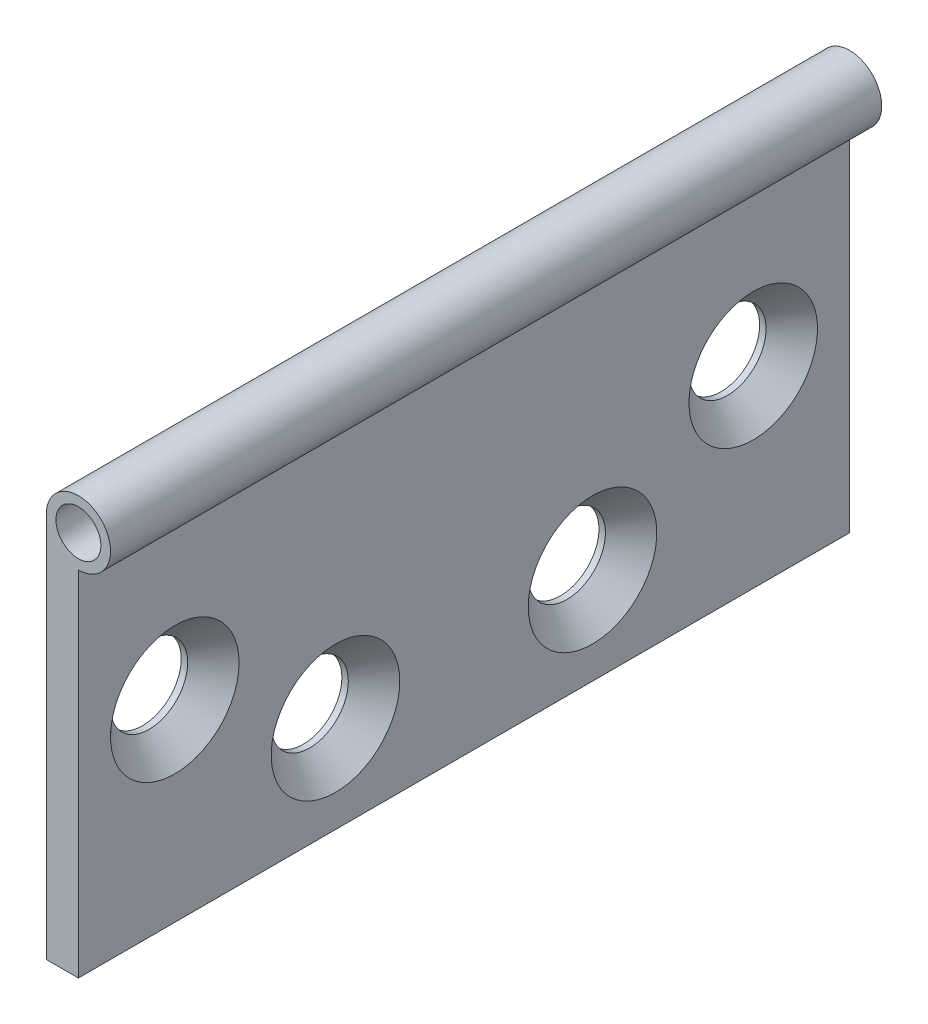
from build123d import *

# Parameters (mm, degrees)
SKETCH_1_W                  = 5
SKETCH_1_H                  = 60
EXTRUDE_2_DEPTH             = 60
SKETCH_2_R                  = 5
SKETCH_3_R                  = 3.5
CUT_EXTRUDE_1_DEPTH         = 137.839321834
HOLE_WIZARD_M101_AT_2_COUNT = 2
HOLE_WIZARD_M101_AT_2_PITCH = 29.154759474


with BuildPart() as part:
    # Эскиз1 → Вытянуть-Тонкостенный2 (new, symmetric)
    with BuildSketch(Plane.XY):
        with Locations((2.5, 30)):
            Rectangle(SKETCH_1_W, SKETCH_1_H)
    extrude(amount=EXTRUDE_2_DEPTH, both=True)

    # По траектории1: sweep along a curve in space
    with BuildLine() as sweep_1_path:
        Line((0, 60, 60), (0, 60, -60))
    # Эскиз2 → По траектории1 (sweep)
    with BuildSketch(Plane.XY.offset(60)):
        with Locations((5, 60)):
            Circle(SKETCH_2_R)
    sweep(path=sweep_1_path.line)

    # Эскиз3 → Вырез-Вытянуть1 (cut, through all)
    with BuildSketch(Plane.XY.offset(60)):
        with Locations((5, 60)):
            Circle(SKETCH_3_R)
    extrude(amount=-CUT_EXTRUDE_1_DEPTH, mode=Mode.SUBTRACT)

    # Эскиз8 → Зенковка для  винта с плоской головкой M101 (revolve, cut)
    with BuildSketch(Plane(origin=(5, 30, 45), x_dir=(0, 0, -1), z_dir=(0, 1, 0))):
        Polygon((0, 0), (0, 5), (6, 5), (6, 4), (10, 0), align=None)
    hole_wizard_m101 = revolve(axis=Axis((11.35, 30, 45), (-1, 0, 0)), mode=Mode.SUBTRACT)

    # Зенковка для  винта с плоской головкой M101 at 2: Зенковка для  винта с плоской головкой M101 ×2
    with Locations(*[Vector(0, -0.5144957554275265, -0.8574929257125442) * (i * HOLE_WIZARD_M101_AT_2_PITCH) for i in range(1, HOLE_WIZARD_M101_AT_2_COUNT)]):
        add(hole_wizard_m101, mode=Mode.SUBTRACT)

    # Зеркальное отражение1: Зенковка для  винта с плоской головкой M101 across plane
    add(hole_wizard_m101.mirror(Plane.XY), mode=Mode.SUBTRACT)

    # Зеркальное отражение1 copy 1 sketch → Зеркальное отражение1 copy 1 (revolve, cut)
    with BuildSketch(Plane(origin=(5, 15, -20), x_dir=(0, 0, 1), z_dir=(0, 1, 0))):
        Polygon((0, 0), (0, -5), (6, -5), (6, -4), (10, 0), align=None)
    revolve(axis=Axis((11.35, 15, -20), (1, 0, 0)), mode=Mode.SUBTRACT)


solid = part.part
